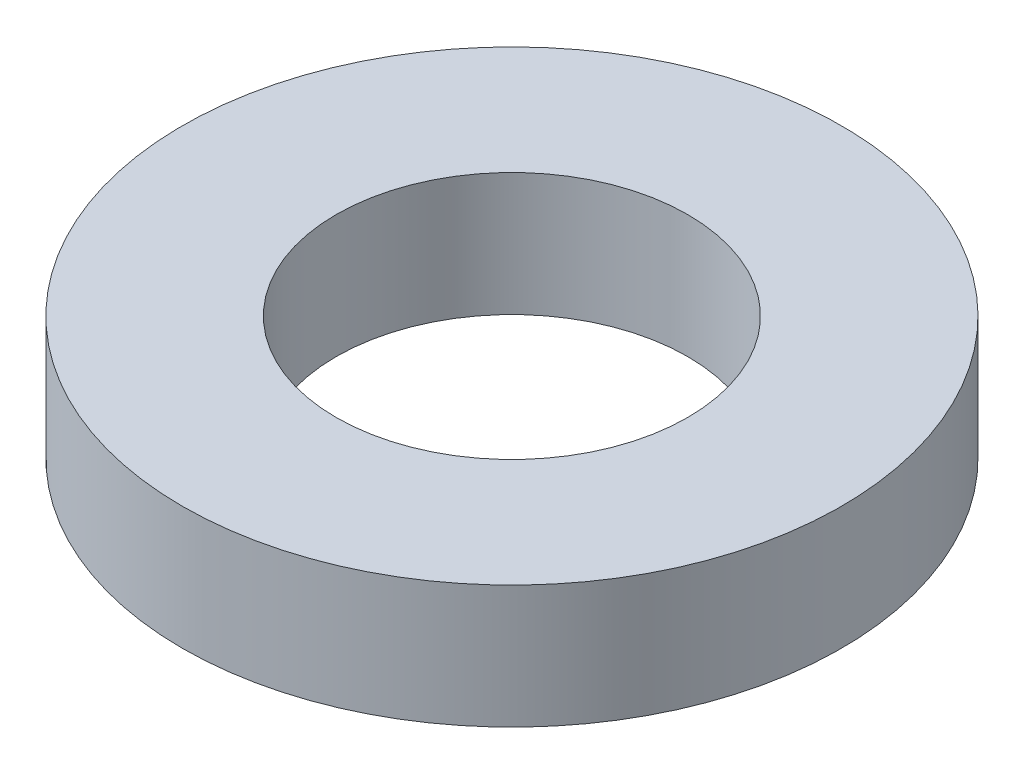
from build123d import *

# Parameters (mm, degrees)
SKETCH_1_R      = 7.5
SKETCH_1_R_2    = 4
EXTRUDE_1_DEPTH = 2.8


with BuildPart() as part:
    # 草图1 → 凸台-拉伸1 (new body)
    with BuildSketch(Plane(origin=(0, 0, 0), x_dir=(1, 0, 0), z_dir=(0, 1, 0))):
        with Locations(Location((0, 0, 0), (0, 0, 270))):
            Circle(SKETCH_1_R)
        with Locations(Location((0, 0, 0), (0, 0, 270))):
            Circle(SKETCH_1_R_2, mode=Mode.SUBTRACT)
    extrude(amount=EXTRUDE_1_DEPTH)


solid = part.part
